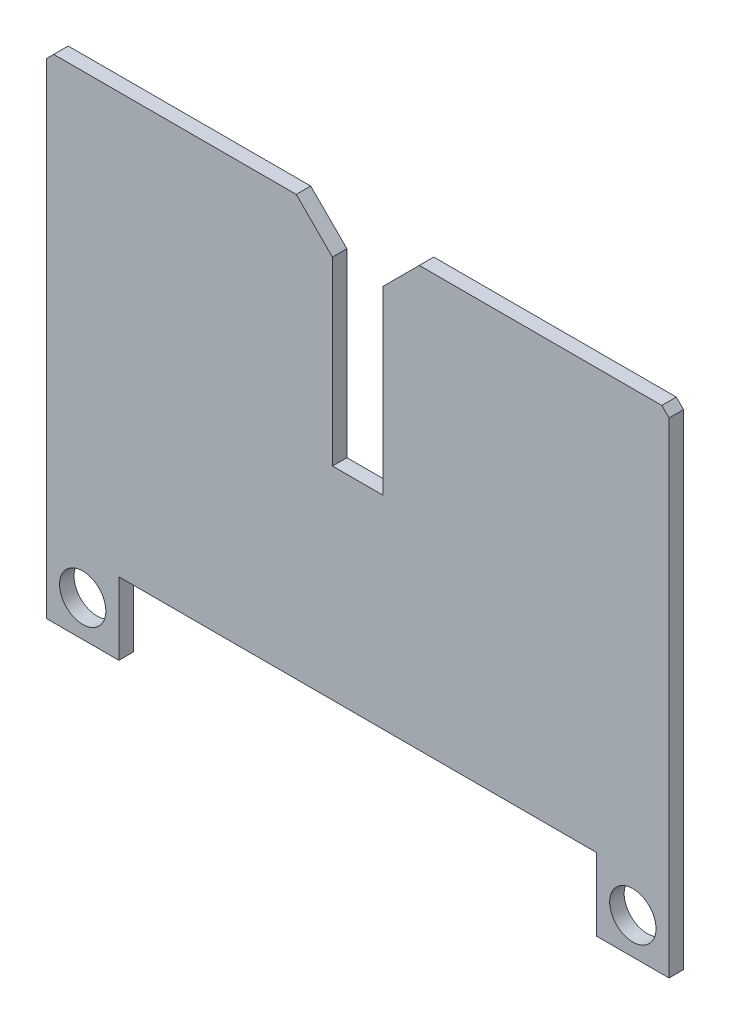
from build123d import *

# Parameters (mm, degrees)
SKETCH1_R           = 1.6
BOSS_EXTRUDE1_DEPTH = 1


with BuildPart() as part:
    # Sketch1 → Boss-Extrude1 (new body)
    with BuildSketch(Plane.XY):
        Polygon((4.25, 7.525), (1.75, 5.025), (1.75, -7.475), (-1.75, -7.475), (-1.75, 5.025), (-4.25, 7.525), (-21, 7.525), (-21.5, 7.025), (-21.5, -26.475), (-16.5, -26.475), (-16.5, -21.475), (16.5, -21.475), (16.5, -26.475), (21.5, -26.475), (21.5, 7.025), (21, 7.525), align=None)
        with Locations((19, -23.975)):
            Circle(SKETCH1_R, mode=Mode.SUBTRACT)
        with Locations((-19, -23.975)):
            Circle(SKETCH1_R, mode=Mode.SUBTRACT)
    extrude(amount=BOSS_EXTRUDE1_DEPTH)


solid = part.part
